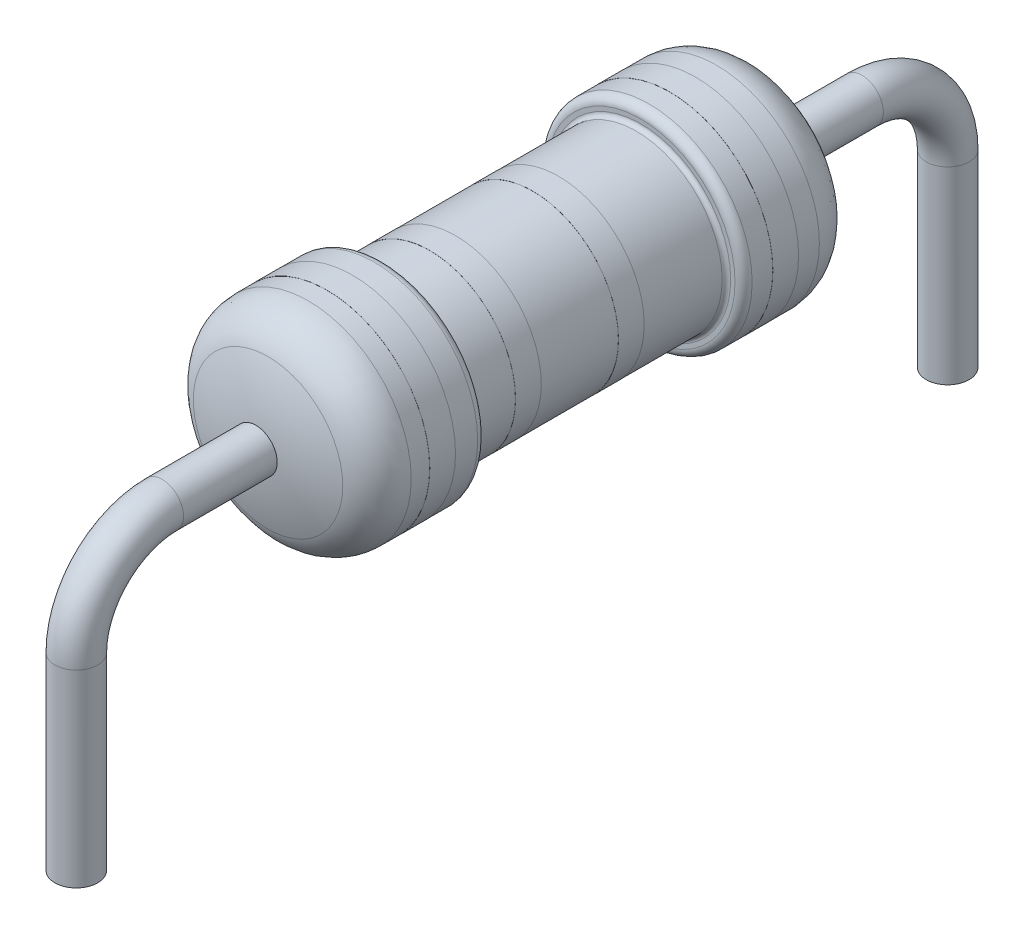
from build123d import *

# Parameters (mm, degrees)
VARREDURA1_PROFILE_R     = 0.25
ESBO_O16_R               = 1.201
ESBO_O16_R_2             = 1.2
RESSALTO_EXTRUS_O1_DEPTH = 0.3
ESBO_O17_R               = 1.201
ESBO_O17_R_2             = 1.2
RESSALTO_EXTRUS_O2_DEPTH = 0.3
ESBO_O18_R               = 1.001
ESBO_O18_R_2             = 1
RESSALTO_EXTRUS_O3_DEPTH = 0.3
ESBO_O19_R               = 1.001
ESBO_O19_R_2             = 1
RESSALTO_EXTRUS_O6_DEPTH = 0.3


with BuildPart() as part:
    # Esboço1 → Revolução1 (revolve)
    with BuildSketch(Plane(origin=(0, 0, 0), x_dir=(0, 0, -1), z_dir=(1, 0, 0)), mode=Mode.PRIVATE) as revolu_o1_sk:
        with BuildLine():
            Line((-0.740760497, 0), (0.759239503, 0))
            Line((0.759239503, 0), (3.759239503, 0))
            Line((3.759239503, 0), (5.259239503, 0))
            add(Edge.make_bspline(
                [(5.112183942, 0.873310117), (5.159777213, 0.744515697), (5.238359199, 0.441306862), (5.259239503, 0.163059126), (5.259239503, 0)],
                knots=[0.299867724, 0.299867724, 0.299867724, 0.299867724, 0.639755429, 1, 1, 1, 1], degree=3))
            ThreePointArc((5.112183942, 0.873310117), (4.928965125, 1.110277381), (4.643181167, 1.2))
            Line((4.643181167, 1.2), (3.859239503, 1.2))
            ThreePointArc((3.859239503, 1.2), (3.788528825, 1.170710678), (3.759239503, 1.1))
            Line((3.759239503, 1.1), (3.759239503, 1.05))
            ThreePointArc((3.759239503, 1.05), (3.744594842, 1.014644661), (3.709239503, 1))
            Line((3.709239503, 1), (0.809239503, 1))
            ThreePointArc((0.809239503, 1), (0.773884164, 1.014644661), (0.759239503, 1.05))
            Line((0.759239503, 1.05), (0.759239503, 1.1))
            ThreePointArc((0.759239503, 1.1), (0.729950181, 1.170710678), (0.659239503, 1.2))
            Line((0.659239503, 1.2), (-0.11555287, 1.2))
            ThreePointArc((-0.11555287, 1.2), (-0.402168626, 1.109696727), (-0.585255019, 0.871405634))
            add(Edge.make_bspline(
                [(-0.740760497, 0), (-0.740760497, 0.148424872), (-0.714842917, 0.442084017), (-0.637090178, 0.729361961), (-0.585255019, 0.871405634)],
                knots=[0, 0, 0, 0, 0.359983191, 0.719966383, 0.719966383, 0.719966383, 0.719966383], degree=3))
        make_face()
    revolve(revolu_o1_sk.sketch.rotate(Axis((0, 0, 13.053718468), (0, 0, -1)), 90), axis=Axis((0, 0, 13.053718468), (0, 0, -1)))

    # Varredura1: sweep along a path in Esboço2
    with BuildLine(Plane(origin=(0, 0, 0), x_dir=(0, 0, -1), z_dir=(1, 0, 0))) as varredura1_path:
        Line((7.339239503, -3.2), (7.339239503, -1))
        ThreePointArc((7.339239503, -1), (7.046346285, -0.292893219), (6.339239503, 0))
        Line((6.339239503, 0), (-1.820760497, 0))
        ThreePointArc((-1.820760497, 0), (-2.527867278, -0.292893219), (-2.820760497, -1))
        Line((-2.820760497, -1), (-2.820760497, -3.2))
    # Varredura1 profile (on start of the path) → Varredura1 (sweep)
    with BuildSketch(Plane(origin=(0, -3.2, -7.339239503), x_dir=(0, 0, 1), z_dir=(0, 1, 0))):
        Circle(VARREDURA1_PROFILE_R)
    sweep(path=varredura1_path.line)

    # Esboço16 → Ressalto-extrusão1 (add)
    with BuildSketch(Plane.XY.offset(-0.1)):
        Circle(ESBO_O16_R)
        Circle(ESBO_O16_R_2, mode=Mode.SUBTRACT)
    extrude(amount=-RESSALTO_EXTRUS_O1_DEPTH)

    # Esboço17 → Ressalto-extrusão2 (add)
    with BuildSketch(Plane.XY.offset(-4.1)):
        Circle(ESBO_O17_R)
        Circle(ESBO_O17_R_2, mode=Mode.SUBTRACT)
    extrude(amount=-RESSALTO_EXTRUS_O2_DEPTH)

    # Esboço18 → Ressalto-extrusão3 (add)
    with BuildSketch(Plane.XY.offset(-1.3)):
        Circle(ESBO_O18_R)
        Circle(ESBO_O18_R_2, mode=Mode.SUBTRACT)
    extrude(amount=-RESSALTO_EXTRUS_O3_DEPTH)

    # Esboço19 → Ressalto-extrusão6 (add)
    with BuildSketch(Plane.XY.offset(-2.5)):
        Circle(ESBO_O19_R)
        Circle(ESBO_O19_R_2, mode=Mode.SUBTRACT)
    extrude(amount=-RESSALTO_EXTRUS_O6_DEPTH)


solid = part.part
